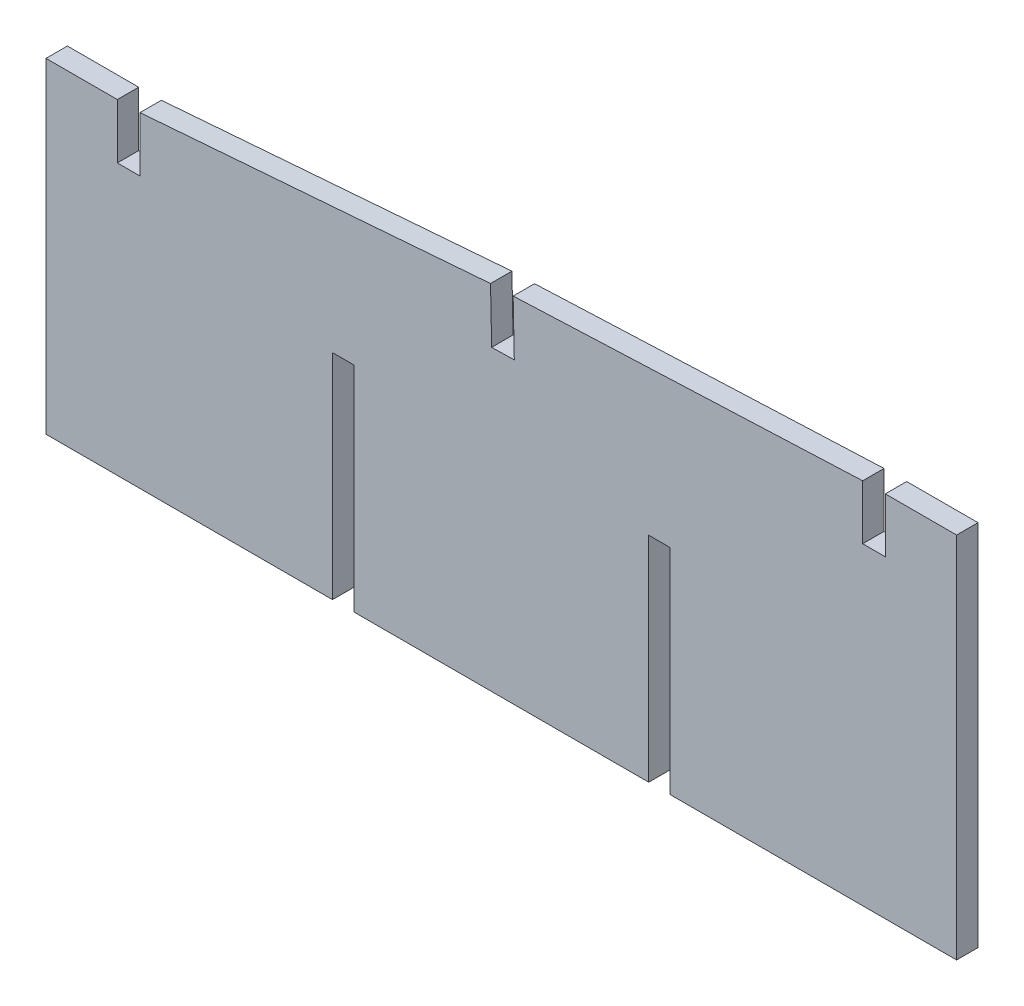
from build123d import *

# Parameters (mm, degrees)
BOSS_EXTRUDE1_DEPTH = 3


with BuildPart() as part:
    # Sketch2 → Boss-Extrude1 (new body)
    with BuildSketch(Plane.XY.offset(-420)):
        Polygon((371.221, 60.405275523), (374.396, 60.405275523), (374.396, 68.048452389), (384.396, 68.048452389), (384.396, 16.438825445), (344.221, 16.438825445), (344.221, 46.438825445), (341.221, 46.438825445), (341.221, 16.438825445), (299.875, 16.438825445), (299.875, 46.438825445), (296.875, 46.438825445), (296.875, 16.438825445), (256.7, 16.438825445), (256.7, 62.088634885), (266.7, 62.088634885), (266.7, 54.389809435), (269.875, 54.389809435), (269.875, 62.08863416), (319.035485474, 65.914500994), (319.194537443, 58.240544169), (322.368863109, 58.306044649), (322.209811102, 65.980003261), (371.221, 68.048453085), align=None)
    extrude(amount=-BOSS_EXTRUDE1_DEPTH)


solid = part.part
